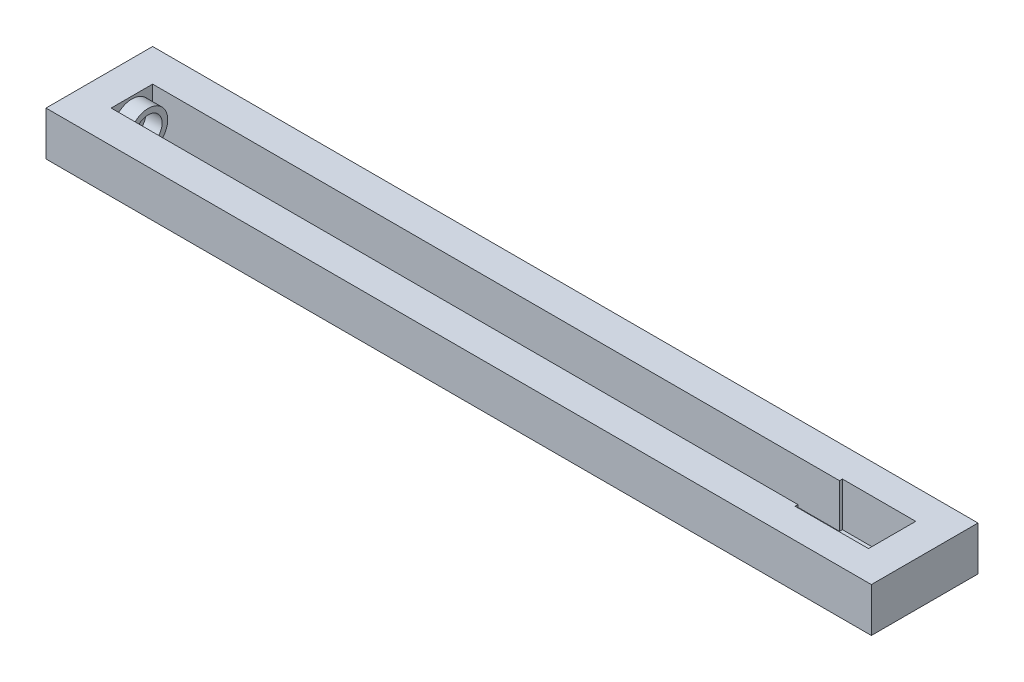
from build123d import *

# Parameters (mm, degrees)
SKETCH1_W           = 760
SKETCH1_H           = 98.2
SKETCH1_W_2         = 700
SKETCH1_H_2         = 38.2
BOSS_EXTRUDE3_DEPTH = 40.64
SKETCH2_W           = 700
SKETCH2_H           = 38.2
BOSS_EXTRUDE4_DEPTH = 0.254
SKETCH3_W           = 67.5
SKETCH3_H           = 43.5
CUT_EXTRUDE1_DEPTH  = 40.386
SKETCH6_R           = 18
SKETCH6_R_2         = 12.8397
BOSS_EXTRUDE5_DEPTH = 15
SKETCH7_W           = 38.1
SKETCH7_H           = 44.37
BOSS_EXTRUDE6_DEPTH = 20


with BuildPart() as part:
    # Sketch1 → Boss-Extrude3 (new body)
    with BuildSketch(Plane(origin=(0, 0, 0), x_dir=(1, 0, 0), z_dir=(0, 1, 0))):
        Rectangle(SKETCH1_W, SKETCH1_H)
        Rectangle(SKETCH1_W_2, SKETCH1_H_2, mode=Mode.SUBTRACT)
    extrude(amount=BOSS_EXTRUDE3_DEPTH)

    # Sketch2 → Boss-Extrude4 (add)
    with BuildSketch(Plane.XZ):
        Rectangle(SKETCH2_W, SKETCH2_H)
    extrude(amount=-BOSS_EXTRUDE4_DEPTH)

    # Sketch3 → Cut-Extrude1 (cut)
    with BuildSketch(Plane(origin=(0, 40.64, 0), x_dir=(1, 0, 0), z_dir=(0, 1, 0))):
        with Locations((316.25, 0)):
            Rectangle(SKETCH3_W, SKETCH3_H)
    extrude(amount=-CUT_EXTRUDE1_DEPTH, mode=Mode.SUBTRACT)

    # Sketch6 → Boss-Extrude5 (add)
    with BuildSketch(Plane(origin=(-350, 0, 0), x_dir=(0, 0, -1), z_dir=(1, 0, 0))):
        with Locations((0, 20.32)):
            Circle(SKETCH6_R)
        with Locations((0, 20.32)):
            Circle(SKETCH6_R_2, mode=Mode.SUBTRACT)
    extrude(amount=BOSS_EXTRUDE5_DEPTH)

    # Sketch7 → Boss-Extrude6 (add)
    with BuildSketch(Plane.XZ):
        Rectangle(SKETCH7_W, SKETCH7_H)
    extrude(amount=BOSS_EXTRUDE6_DEPTH)


solid = part.part
